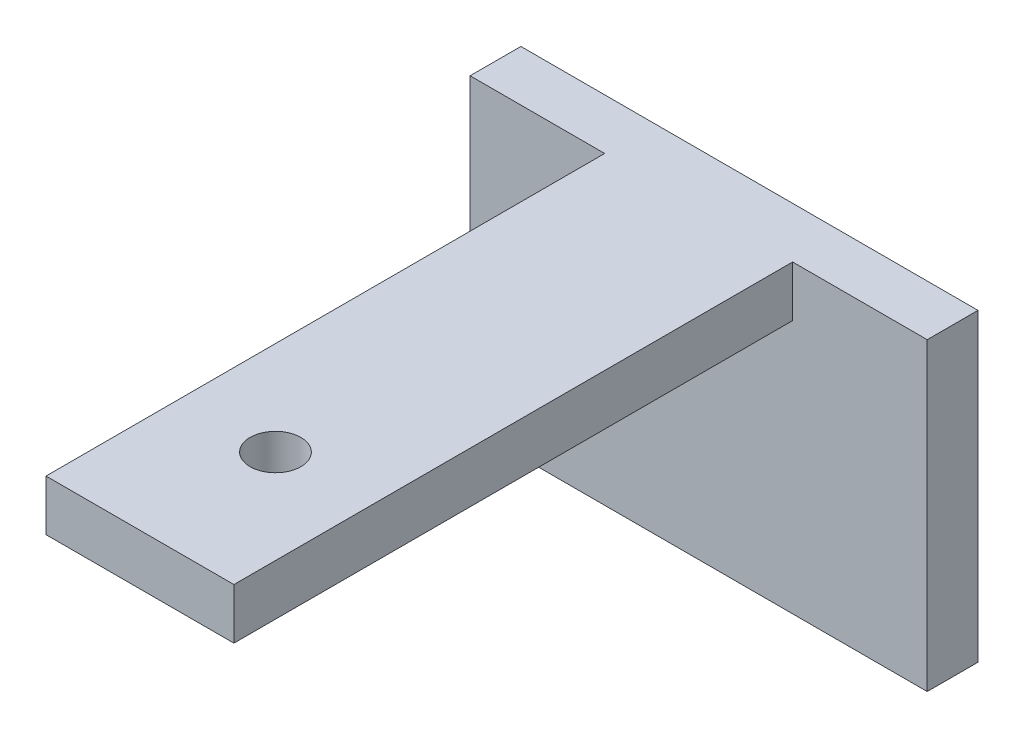
from build123d import *

# Parameters (mm, degrees)
SKETCH1_W           = 45
SKETCH1_H           = 30
BOSS_EXTRUDE1_DEPTH = 5
SKETCH2_W           = 18.5
SKETCH2_H           = 5
BOSS_EXTRUDE2_DEPTH = 55
SKETCH3_R           = 2.5
CUT_EXTRUDE1_DEPTH  = 10


with BuildPart() as part:
    # Sketch1 → Boss-Extrude1 (new body)
    with BuildSketch(Plane.XY):
        Rectangle(SKETCH1_W, SKETCH1_H)
    extrude(amount=BOSS_EXTRUDE1_DEPTH)

    # Sketch2 → Boss-Extrude2 (add)
    with BuildSketch(Plane.XY.offset(5)):
        with Locations((0, 12.5)):
            Rectangle(SKETCH2_W, SKETCH2_H)
    extrude(amount=BOSS_EXTRUDE2_DEPTH)

    # Sketch3 → Cut-Extrude1 (cut)
    with BuildSketch(Plane(origin=(0, 15, 0), x_dir=(1, 0, 0), z_dir=(0, 1, 0))):
        with Locations(Location((0, -46.66, 0), (0, 0, 180))):
            Circle(SKETCH3_R)
    extrude(amount=-CUT_EXTRUDE1_DEPTH, mode=Mode.SUBTRACT)


solid = part.part
